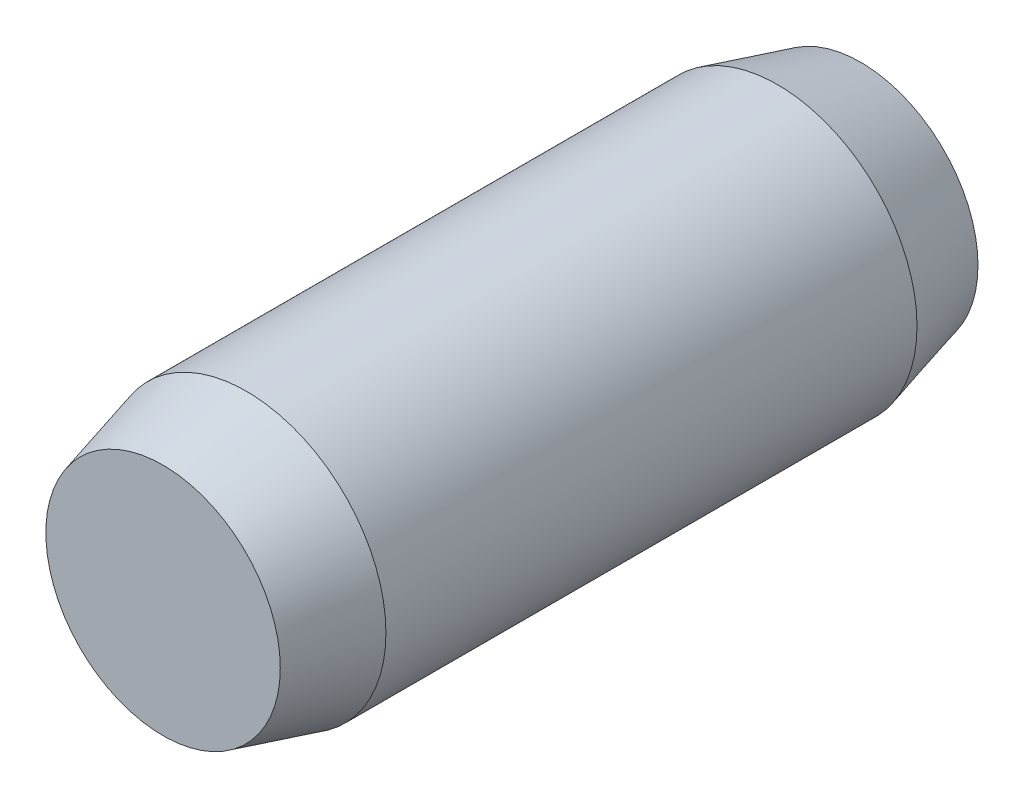
from build123d import *


with BuildPart() as part:
    # Sketch3 → Revolve1 (revolve)
    with BuildSketch(Plane(origin=(0, 0, 0), x_dir=(0, 0, -1), z_dir=(1, 0, 0)), mode=Mode.PRIVATE) as revolve1_sk:
        Polygon((-3.96875, 0), (-3.96875, 1.3335), (-3.020809095, 1.5875), (3.020809095, 1.5875), (3.96875, 1.3335), (3.96875, 0), align=None)
    revolve(revolve1_sk.sketch.rotate(Axis((0, 0, 3.96875), (0, 0, -1)), 90), axis=Axis((0, 0, 3.96875), (0, 0, -1)))


solid = part.part
